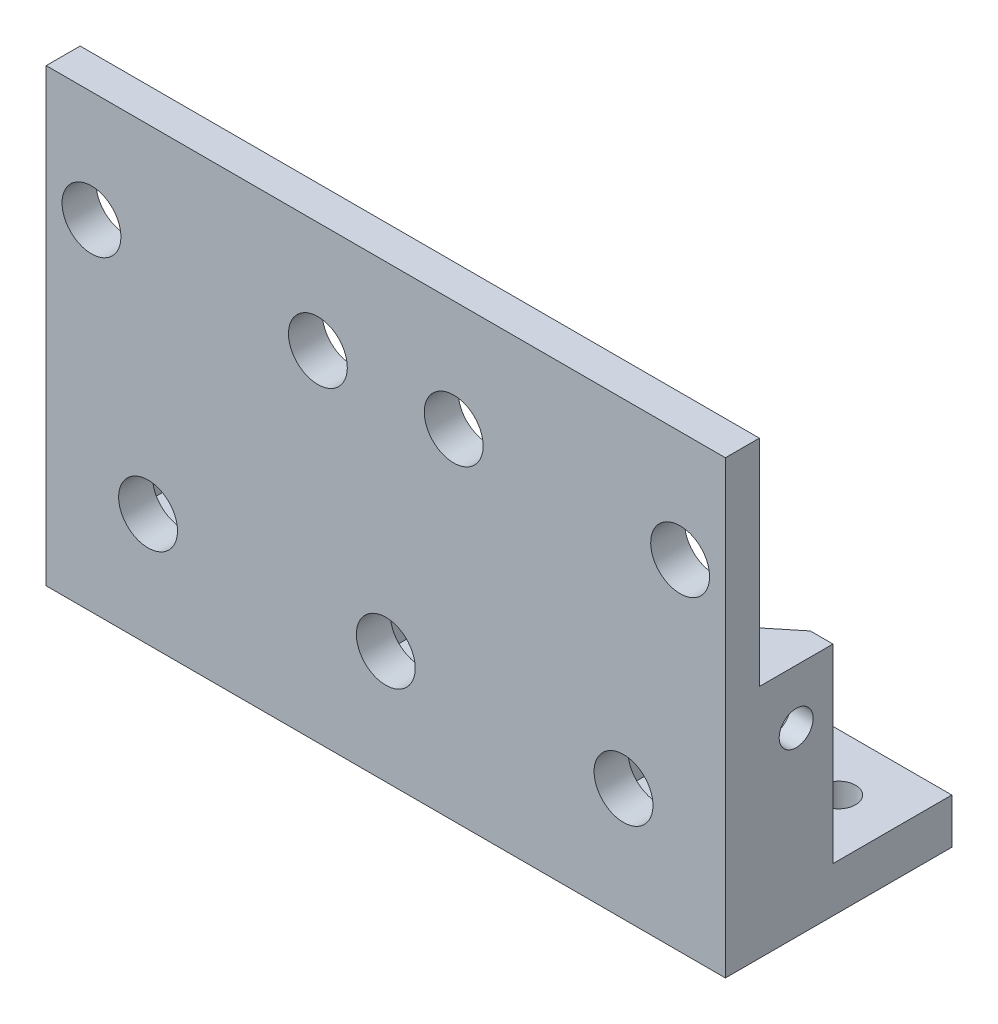
from build123d import *

# Parameters (mm, degrees)
EXTRUDE_1_DEPTH     = 60
SKETCH_2_W          = 15
SKETCH_2_H          = 17
SKETCH_2_W_2        = 12
CUT_EXTRUDE_1_DEPTH = 60
HOLE_WIZARD_1_D     = 5.2
HOLE_WIZARD_2_D     = 3
SKETCH_7_R          = 1.5
EXTRUDE_2_DEPTH     = 2
EXTRUDE_3_DEPTH     = 1.8
HOLE_WIZARD_3_D     = 5.2


with BuildPart() as part:
    # 草图1 → 凸台-拉伸1 (new body)
    with BuildSketch(Plane(origin=(0, 0, 0), x_dir=(0, 0, -1), z_dir=(1, 0, 0))):
        Polygon((-1.5, 19.9), (1.5, 19.9), (1.5, -0.1), (18.5, -15.9), (18.5, -19.9), (1.5, -19.9), (-1.5, -19.9), align=None)
    extrude(amount=EXTRUDE_1_DEPTH)

    # 草图2 → 切除-拉伸1 (cut)
    with BuildSketch(Plane(origin=(0, -15.9, 0), x_dir=(-1, 0, 0), z_dir=(0, -1, 0))):
        with Locations((-52.5, 10)):
            Rectangle(SKETCH_2_W, SKETCH_2_H)
        with Locations((-7.5, 10)):
            Rectangle(SKETCH_2_W, SKETCH_2_H)
        with Locations((-30, 10)):
            Rectangle(SKETCH_2_W_2, SKETCH_2_H)
    extrude(amount=-CUT_EXTRUDE_1_DEPTH, mode=Mode.SUBTRACT)

    # 孔1 (through all)
    with Locations(Plane(origin=(0, 0, -1.5), x_dir=(-1, 0, 0), z_dir=(0, 0, -1))):
        with Locations((-51, -9.9), (-30, -9.9), (-9, -9.9)):
            Hole(HOLE_WIZARD_1_D / 2)

    # 孔2 (through all)
    with Locations(Plane(origin=(0, -19.9, 0), x_dir=(-1, 0, 0), z_dir=(0, -1, 0))):
        with Locations((-55, 13.5), (-30, 13.5), (-5, 13.5)):
            Hole(HOLE_WIZARD_2_D / 2)

    # 草图7 → 凸台-拉伸2 (add)
    with BuildSketch(Plane.ZY):
        Polygon((-1.5, -0.9), (-8, -0.9), (-8, -6.9), (-8, -15.9), (-1.5, -15.9), (-1.5, -6.9), align=None)
        with Locations((-4.75, -3.9)):
            Circle(SKETCH_7_R, mode=Mode.SUBTRACT)
    extrude_2 = extrude(amount=-EXTRUDE_2_DEPTH)

    # 草图8 → 凸台-拉伸3 (add)
    with BuildSketch(Plane(origin=(0, -0.9, 0), x_dir=(1, 0, 0), z_dir=(0, 1, 0))):
        Polygon((2, 8), (10, 1.5), (2, 1.5), (0, 1.5), (0, 8), align=None)
    extrude_3 = extrude(amount=EXTRUDE_3_DEPTH)

    # 孔3 (through all)
    with Locations(Plane(origin=(56, 10.1, -1.5), x_dir=(0, -1, 0), z_dir=(0, 0, -1))):
        with Locations((0, 0), (0, 20), (0, 32), (0, 52)):
            Hole(HOLE_WIZARD_3_D / 2)

    # 镜向1: 凸台-拉伸2, 凸台-拉伸3 across plane
    add(extrude_2.mirror(Plane.ZY.offset(-30)))
    add(extrude_3.mirror(Plane.ZY.offset(-30)))


solid = part.part
